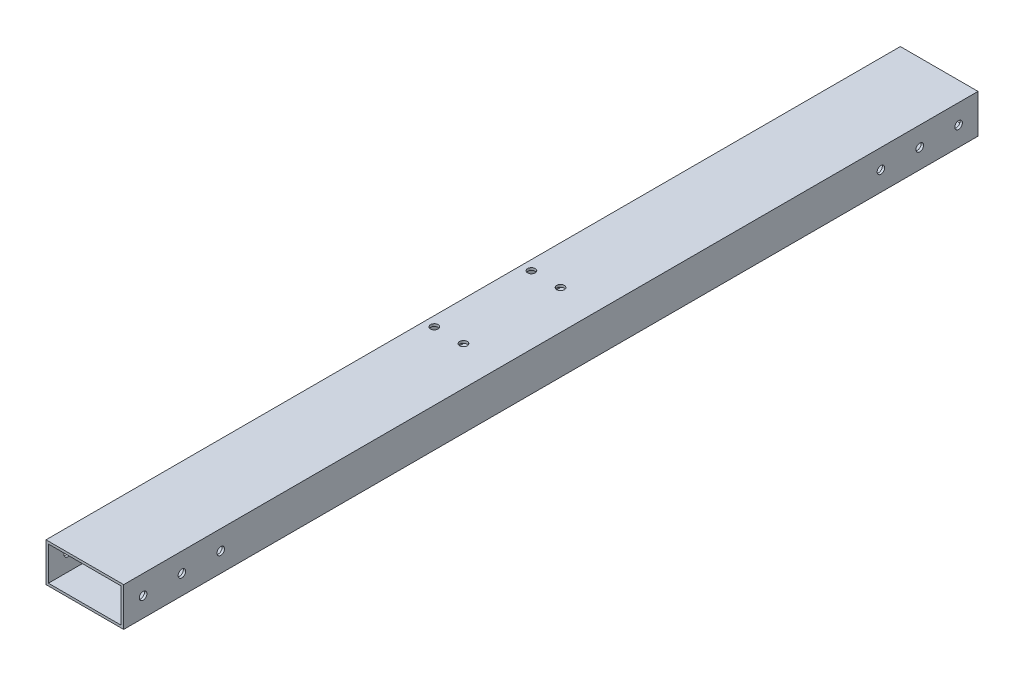
from build123d import *

# Parameters (mm, degrees)
SKETCH1_W               = 50.8
SKETCH1_H               = 25.4
BOSS_EXTRUDE1_DEPTH     = 279.4
SHELL1_T                = -1.5875
CUT_EXTRUDE1_DEPTH      = 281.839473721
CUT_EXTRUDE1_DEPTH_BACK = 281.839473721
SKETCH3_R               = 2.4892
CUT_EXTRUDE2_DEPTH      = 281.839473721
CUT_EXTRUDE2_DEPTH_BACK = 281.839473721
SKETCH4_R               = 2.4892


with BuildPart() as part:
    # Sketch1 → Boss-Extrude1 (new, symmetric)
    with BuildSketch(Plane.XY):
        Rectangle(SKETCH1_W, SKETCH1_H)
    extrude(amount=BOSS_EXTRUDE1_DEPTH, both=True)

    # Shell1
    shell1_openings = [part.faces().sort_by_distance(p)[0] for p in [
        (0, 0, 279.4),
        (0, 0, -279.4),
    ]]
    offset(amount=SHELL1_T, openings=shell1_openings, kind=Kind.INTERSECTION)

    # Sketch3 → Cut-Extrude1 (cut, two sides: drawn at the far end of the back side and taken through both)
    with BuildSketch(Plane(origin=(0, 0, 0), x_dir=(0, 0, -1), z_dir=(1, 0, 0)).offset(-CUT_EXTRUDE1_DEPTH_BACK)):
        with Locations((-266.7, 0)):
            Circle(SKETCH3_R)
        with Locations((-241.3, 0)):
            Circle(SKETCH3_R)
        with Locations((-215.9, 0)):
            Circle(SKETCH3_R)
        with Locations((215.9, 0)):
            Circle(SKETCH3_R)
        with Locations((241.3, 0)):
            Circle(SKETCH3_R)
        with Locations((266.7, 0)):
            Circle(SKETCH3_R)
    extrude(amount=CUT_EXTRUDE1_DEPTH + CUT_EXTRUDE1_DEPTH_BACK, mode=Mode.SUBTRACT)

    # Sketch4 → Cut-Extrude2 (cut, two sides: drawn at the far end of the back side and taken through both)
    with BuildSketch(Plane(origin=(0, 0, 0), x_dir=(1, 0, 0), z_dir=(0, 1, 0)).offset(-CUT_EXTRUDE2_DEPTH_BACK)):
        with Locations(Location((0, -31.75, 0), (0, 0, 270))):
            Circle(SKETCH4_R)
        with Locations(Location((-19.05, -31.75, 0), (0, 0, 270))):
            Circle(SKETCH4_R)
        with Locations(Location((0, 31.75, 0), (0, 0, 270))):
            Circle(SKETCH4_R)
        with Locations(Location((-19.05, 31.75, 0), (0, 0, 270))):
            Circle(SKETCH4_R)
    extrude(amount=CUT_EXTRUDE2_DEPTH + CUT_EXTRUDE2_DEPTH_BACK, mode=Mode.SUBTRACT)


solid = part.part
